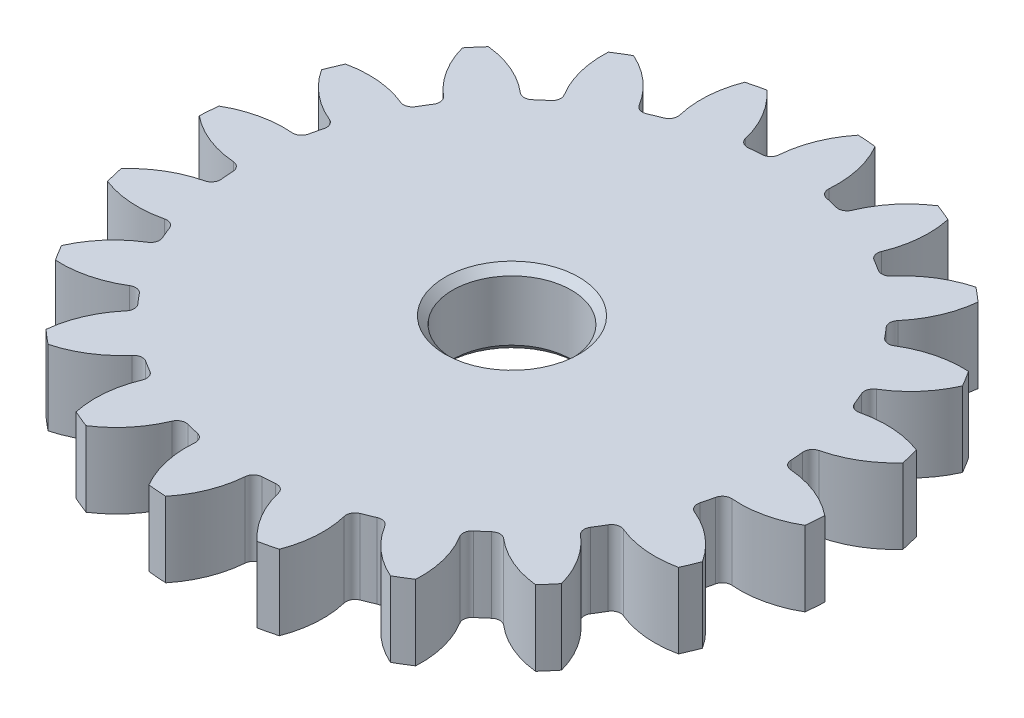
from build123d import *

# Parameters (mm, degrees)
SALIENTE_EXTRUIR1_DEPTH = 10
REDONDEO1_R             = 1.2
MATRIZC1_COUNT          = 20
REDONDEO1_OF_MATRIZC1_R = 1.2
CROQUIS3_R              = 7.92
CORTAR_EXTRUIR1_DEPTH   = 10
CHAFL_N1_SIZE           = 1


with BuildPart() as part:
    # Croquis2 → Saliente-Extruir1 (new body)
    with BuildSketch(Plane(origin=(0, 0, 0), x_dir=(1, 0, 0), z_dir=(0, 1, 0))):
        with BuildLine():
            ThreePointArc((-0.825106662, 35.322364346), (-2.77497528, -35.222858149), (6.346224934, 34.757382713))
            ThreePointArc((6.346224934, 34.757382713), (6.284410184, 39.398014921), (4.674718544, 43.750965778))
            ThreePointArc((4.674718544, 43.750965778), (3.45576, 43.864082378), (2.234126356, 43.943243843))
            ThreePointArc((2.234126356, 43.943243843), (-0.037355772, 39.896064913), (-0.825106662, 35.322364346))
        make_face()
    saliente_extruir1 = extrude(amount=-SALIENTE_EXTRUIR1_DEPTH)

    # Redondeo1
    redondeo1_edges = [part.edges().sort_by_distance(p)[0] for p in [
        (6.346224934, -5, -34.757382713),
        (-0.825106662, -5, -35.322364346),
    ]]
    fillet(redondeo1_edges, radius=REDONDEO1_R)

    # MatrizC1: Saliente-Extruir1 ×20 about axis
    matrizc1_axis = Axis((0, 0, 0), (0, 1, 0))
    for i in range(1, MATRIZC1_COUNT):
        add(saliente_extruir1.rotate(matrizc1_axis, i * 360 / MATRIZC1_COUNT))

    # Redondeo1 of MatrizC1
    redondeo1_of_matrizc1_edges = [part.edges().sort_by_distance(p)[0] for p in [
        (-4.705003361, -5, -35.017326674),
        (-11.699933932, -5, -33.338592802),
        (-15.295673146, -5, -31.849530719),
        (-21.42949015, -5, -28.09140751),
        (-24.389095871, -5, -25.564080789),
        (-29.061378565, -5, -20.094439527),
        (-31.095143964, -5, -16.776240516),
        (-33.848536763, -5, -10.130487797),
        (-34.757382713, -5, -6.346224934),
        (-35.322364346, -5, 0.825106662),
        (-35.017326674, -5, 4.705003361),
        (-33.338592802, -5, 11.699933932),
        (-31.849530719, -5, 15.295673146),
        (-28.09140751, -5, 21.42949015),
        (-25.564080789, -5, 24.389095871),
        (-20.094439527, -5, 29.061378565),
        (-16.776240516, -5, 31.095143964),
        (-10.130487797, -5, 33.848536763),
        (-6.346224934, -5, 34.757382713),
        (0.825106662, -5, 35.322364346),
        (4.705003361, -5, 35.017326674),
        (11.699933932, -5, 33.338592802),
        (15.295673146, -5, 31.849530719),
        (21.42949015, -5, 28.09140751),
        (24.389095871, -5, 25.564080789),
        (29.061378565, -5, 20.094439527),
        (31.095143964, -5, 16.776240516),
        (33.848536763, -5, 10.130487797),
        (34.757382713, -5, 6.346224934),
        (35.322364346, -5, -0.825106662),
        (35.017326674, -5, -4.705003361),
        (33.338592802, -5, -11.699933932),
        (31.849530719, -5, -15.295673146),
        (28.09140751, -5, -21.42949015),
        (25.564080789, -5, -24.389095871),
        (20.094439527, -5, -29.061378565),
        (16.776240516, -5, -31.095143964),
        (10.130487797, -5, -33.848536763),
    ]]
    fillet(redondeo1_of_matrizc1_edges, radius=REDONDEO1_OF_MATRIZC1_R)

    # Croquis3 → Cortar-Extruir1 (cut)
    with BuildSketch(Plane(origin=(0, 0, 0), x_dir=(1, 0, 0), z_dir=(0, 1, 0))):
        with Locations(Location((0, 0, 0), (0, 0, 270))):
            Circle(CROQUIS3_R)
    extrude(amount=-CORTAR_EXTRUIR1_DEPTH, mode=Mode.SUBTRACT)

    # Chaflán1
    chafl_n1_edges = [part.edges().sort_by_distance(p)[0] for p in [
        (0, -10, -7.92),
        (0, 0, -7.92),
    ]]
    chamfer(chafl_n1_edges, length=CHAFL_N1_SIZE)


solid = part.part
